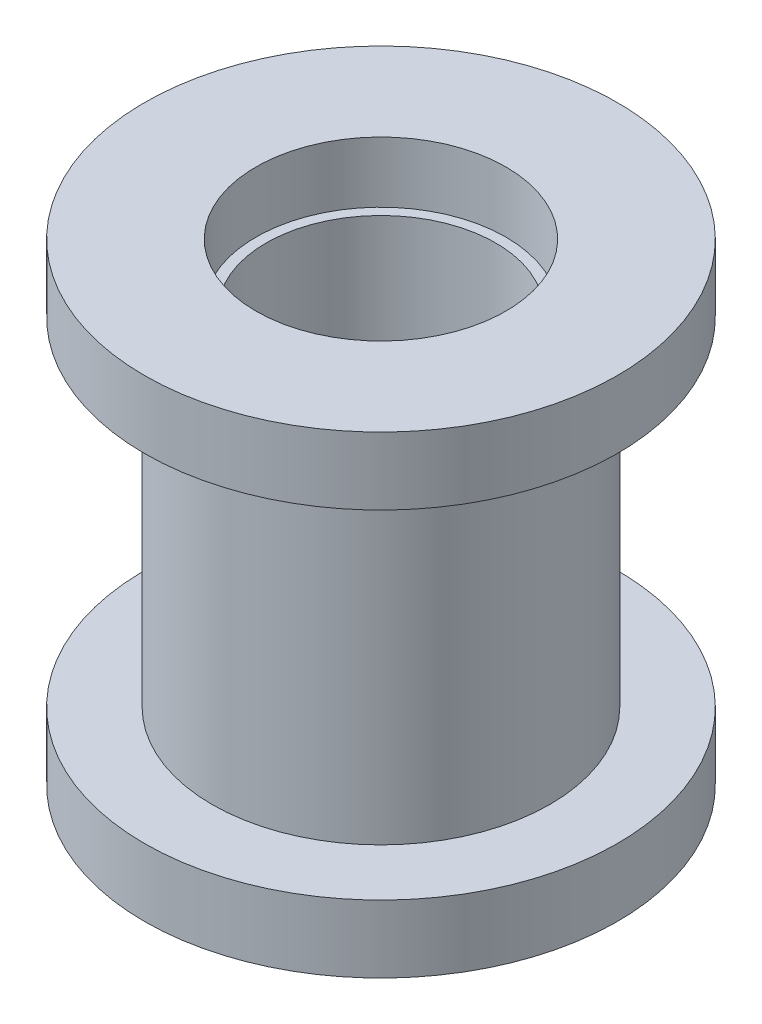
from build123d import *

# Parameters (mm, degrees)
SKETCH_1_R          = 35
EXTRUDE_1_DEPTH     = 10
SKETCH_5_R          = 25
EXTRUDE_2_DEPTH     = 50
SKETCH_6_R          = 35
EXTRUDE_3_DEPTH     = 10
SKETCH_7_R          = 18.5
CUT_EXTRUDE_1_DEPTH = 9
SKETCH_8_R          = 17
CUT_EXTRUDE_2_DEPTH = 52
SKETCH_9_R          = 18.5
CUT_EXTRUDE_3_DEPTH = 79.555712714


with BuildPart() as part:
    # 草图1 → 凸台-拉伸1 (new body)
    with BuildSketch(Plane(origin=(0, 0, 0), x_dir=(1, 0, 0), z_dir=(0, 1, 0))):
        with Locations(Location((0, 0, 0), (0, 0, 270))):
            Circle(SKETCH_1_R)
    extrude(amount=EXTRUDE_1_DEPTH)

    # 草图5 → 凸台-拉伸2 (add)
    with BuildSketch(Plane(origin=(0, 10, 0), x_dir=(1, 0, 0), z_dir=(0, 1, 0))):
        with Locations(Location((0, 0, 0), (0, 0, 270))):
            Circle(SKETCH_5_R)
    extrude(amount=EXTRUDE_2_DEPTH)

    # 草图6 → 凸台-拉伸3 (add)
    with BuildSketch(Plane(origin=(0, 60, 0), x_dir=(1, 0, 0), z_dir=(0, 1, 0))):
        with Locations(Location((0, 0, 0), (0, 0, 270))):
            Circle(SKETCH_6_R)
    extrude(amount=EXTRUDE_3_DEPTH)

    # 草图7 → 切除-拉伸1 (cut)
    with BuildSketch(Plane(origin=(0, 70, 0), x_dir=(1, 0, 0), z_dir=(0, 1, 0))):
        with Locations(Location((0, 0, 0), (0, 0, 270))):
            Circle(SKETCH_7_R)
    extrude(amount=-CUT_EXTRUDE_1_DEPTH, mode=Mode.SUBTRACT)

    # 草图8 → 切除-拉伸2 (cut)
    with BuildSketch(Plane(origin=(0, 61, 0), x_dir=(1, 0, 0), z_dir=(0, 1, 0))):
        with Locations(Location((0, 0, 0), (0, 0, 270))):
            Circle(SKETCH_8_R)
    extrude(amount=-CUT_EXTRUDE_2_DEPTH, mode=Mode.SUBTRACT)

    # 草图9 → 切除-拉伸3 (cut, through all)
    with BuildSketch(Plane(origin=(0, 9, 0), x_dir=(1, 0, 0), z_dir=(0, 1, 0))):
        with Locations(Location((0, 0, 0), (0, 0, 270))):
            Circle(SKETCH_9_R)
    extrude(amount=-CUT_EXTRUDE_3_DEPTH, mode=Mode.SUBTRACT)


solid = part.part
